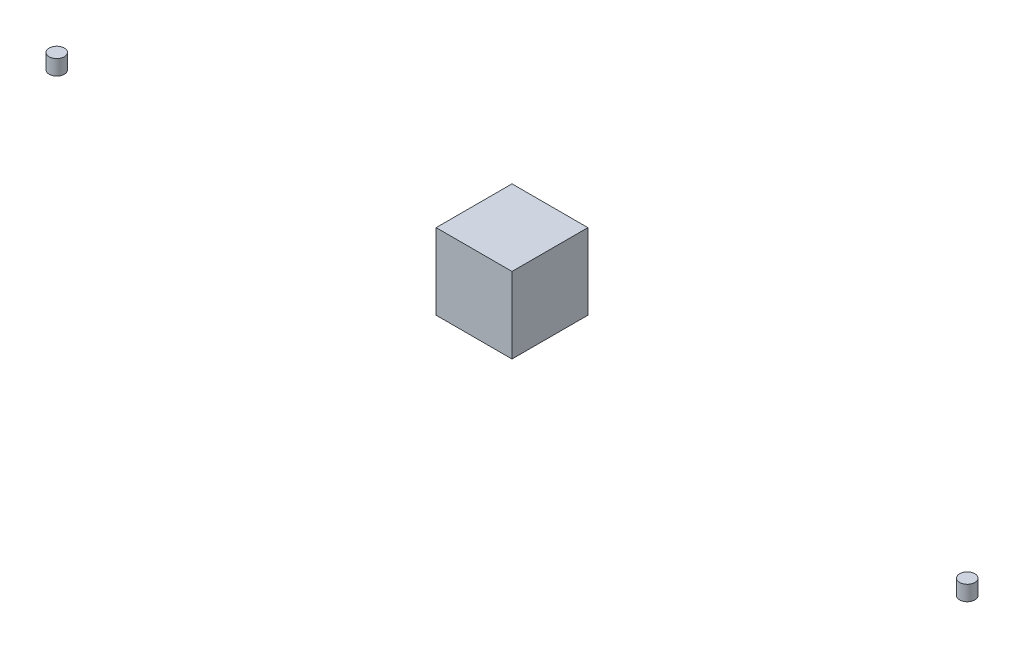
from build123d import *

# Parameters (mm, degrees)
SKETCH1_W             = 50
SKETCH1_H             = 50
BOSS_EXTRUDE1_DEPTH   = 50
SKETCH2_R             = 5
BOSS_EXTRUDE2_DEPTH   = 10
BOSS_EXTRUDE2_2_DEPTH = 10
SKETCH3_R             = 5
BOSS_EXTRUDE3_DEPTH   = 10


with BuildPart() as part:
    # Sketch1 → Boss-Extrude1 (new body)
    with BuildSketch(Plane(origin=(0, 0, 0), x_dir=(1, 0, 0), z_dir=(0, 1, 0))):
        Rectangle(SKETCH1_W, SKETCH1_H)
    extrude(amount=BOSS_EXTRUDE1_DEPTH)

    # Sketch3 → Boss-Extrude3 (add)
    with BuildSketch(Plane.ZY.offset(25)):
        with Locations(Location((0, 25, 0), (0, 0, 180))):
            Circle(SKETCH3_R)
    extrude(amount=BOSS_EXTRUDE3_DEPTH)


with BuildPart() as body_2:
    # Sketch2 → Boss-Extrude2 (new body)
    with BuildSketch(Plane.XZ):
        with Locations(Location((-300, 0, 0), (0, 0, 270))):
            Circle(SKETCH2_R)
    extrude(amount=BOSS_EXTRUDE2_DEPTH)


with BuildPart() as body_3:
    # Sketch2 → Boss-Extrude2 2 (new body)
    with BuildSketch(Plane.XZ):
        with Locations(Location((300, 0, 0), (0, 0, 90))):
            Circle(SKETCH2_R)
    extrude(amount=BOSS_EXTRUDE2_2_DEPTH)


solid = Compound([part.part, body_2.part, body_3.part])
